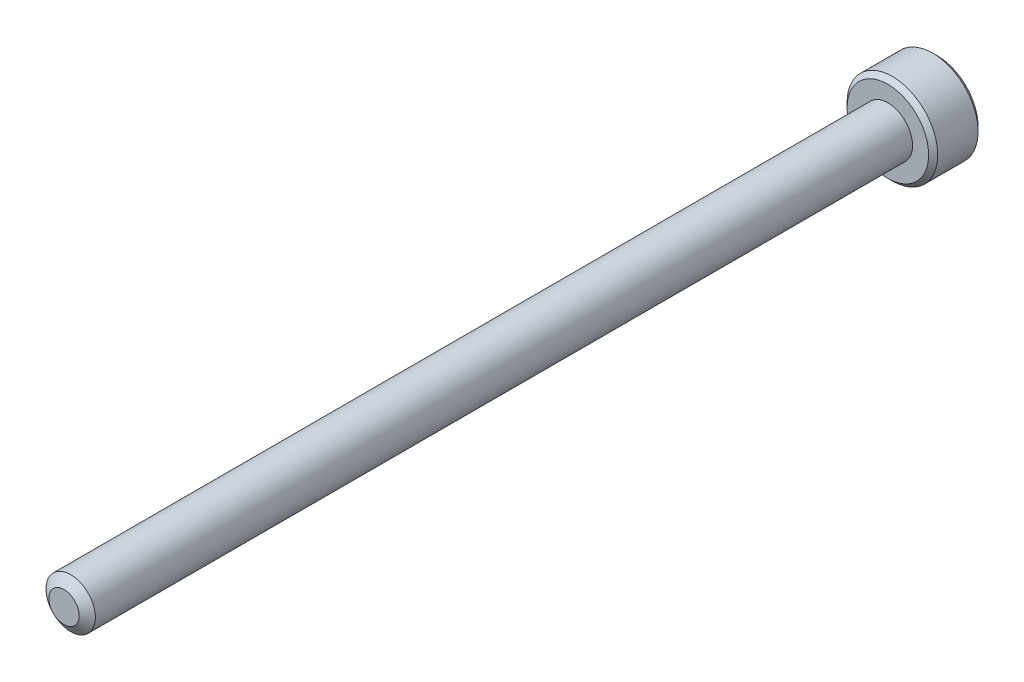
from build123d import *

# Parameters (mm, degrees)
SKETCH1_R          = 1.5
EXTRUDE1_DEPTH     = 50
SKETCH6_R          = 2.75
EXTRUDE2_DEPTH     = 3
CUT_EXTRUDE1_DEPTH = 1.875
CHAMFER1_SIZE      = 0.275


with BuildPart() as part:
    # Sketch1 → Extrude1 (new body)
    with BuildSketch(Plane.XY):
        Circle(SKETCH1_R)
    extrude(amount=-EXTRUDE1_DEPTH)

    # Sketch4 → Cut-Revolve1 (revolve, cut)
    with BuildSketch(Plane(origin=(0, 0, 0), x_dir=(0, 0, -1), z_dir=(1, 0, 0)), mode=Mode.PRIVATE) as cut_revolve1_sk:
        Polygon((0.405251783, 1.5), (0, 0.921240474), (0, 1.5), align=None)
    revolve(cut_revolve1_sk.sketch.rotate(Axis((0, 0, 0), (0, 0, -1)), 90), axis=Axis((0, 0, 0), (0, 0, -1)), mode=Mode.SUBTRACT)

    # Sketch6 → Extrude2 (add)
    with BuildSketch(Plane(origin=(0, 0, -50), x_dir=(-1, 0, 0), z_dir=(0, 0, -1))):
        Circle(SKETCH6_R)
    extrude(amount=EXTRUDE2_DEPTH)

    # Sketch7 → Cut-Extrude1 (cut)
    with BuildSketch(Plane(origin=(0, 0, -53), x_dir=(-1, 0, 0), z_dir=(0, 0, -1))):
        Polygon((0, 1.443375673), (-1.25, 0.721687836), (-1.25, -0.721687836), (0, -1.443375673), (1.25, -0.721687836), (1.25, 0.721687836), align=None)
    extrude(amount=-CUT_EXTRUDE1_DEPTH, mode=Mode.SUBTRACT)

    # Cut-Extrude2 cone 1 section (through the dimple's axis) → Cut-Extrude2 (revolve, cut)
    with BuildSketch(Plane(origin=(0, 0, -53), x_dir=(0, 1, 0), z_dir=(1, 0, 0))):
        Polygon((0, 0), (1.443375673, 0), (0, 1.443375673), align=None)
    revolve(axis=Axis((0, 0, -53), (0, 0, 1)), mode=Mode.SUBTRACT)

    # Chamfer1
    chamfer1_edges = [part.edges().sort_by_distance(p)[0] for p in [
        (2.75, 0, -50),
        (2.75, 0, -53),
    ]]
    chamfer(chamfer1_edges, length=CHAMFER1_SIZE)


solid = part.part
